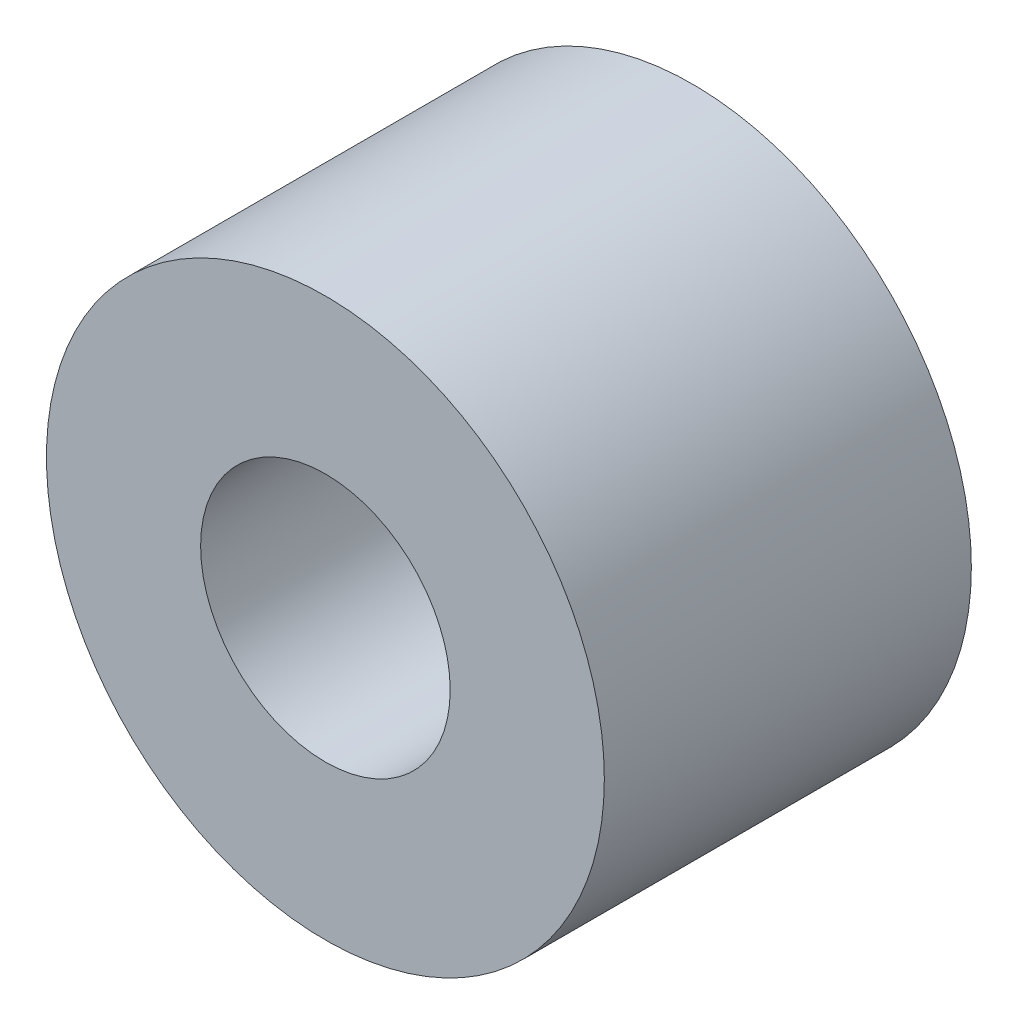
from build123d import *

# Parameters (mm, degrees)
ESBO_O1_R       = 19
ESBO_O1_R_2     = 8.5
EXTRUS_O1_DEPTH = 25


with BuildPart() as part:
    # Esboço1 → Extrusão1 (new body)
    with BuildSketch(Plane.XY):
        Circle(ESBO_O1_R)
        Circle(ESBO_O1_R_2, mode=Mode.SUBTRACT)
    extrude(amount=EXTRUS_O1_DEPTH)


solid = part.part
